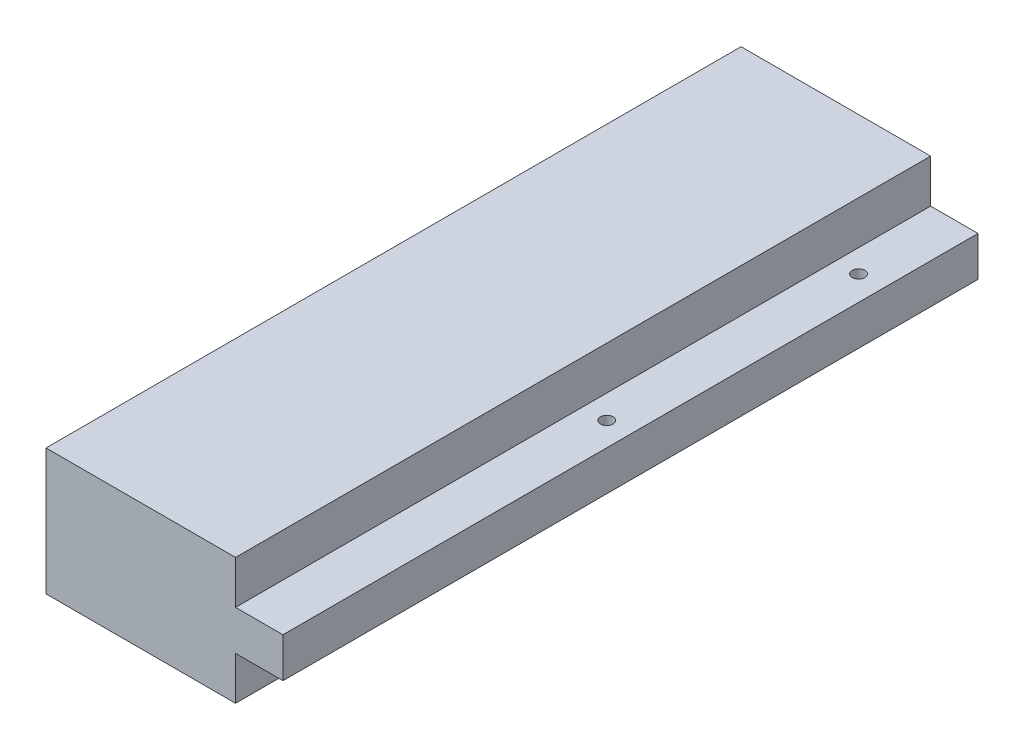
from build123d import *

# Parameters (mm, degrees)
BOSS_EXTRU_1_DEPTH      = 1100
ENL_V_MAT_EXTRU_1_REACH = 1171.58
ESQUISSE2_R             = 10
ENL_V_MAT_EXTRU_2_REACH = 1171.58
ESQUISSE3_R             = 10


with BuildPart() as part:
    # Esquisse1 → Boss.-Extru.1 (new body)
    with BuildSketch(Plane.XY):
        Polygon((0, 0), (300, 0), (300, 68.5), (375, 68.5), (375, 131.5), (300, 131.5), (300, 200), (0, 200), align=None)
    extrude(amount=BOSS_EXTRU_1_DEPTH)

    # Esquisse2 → Enlèv. mat.-Extru.1 (cut, up to next)
    with BuildSketch(Plane.XZ.offset(-68.5), mode=Mode.PRIVATE) as enl_v_mat_extru_1_sk1:
        with Locations(Location((337.5, 550, 0), (0, 0, 270))):
            Circle(ESQUISSE2_R)
    enl_v_mat_extru_1_tool1 = extrude(enl_v_mat_extru_1_sk1.sketch, amount=-ENL_V_MAT_EXTRU_1_REACH, mode=Mode.PRIVATE) & part.part
    add(enl_v_mat_extru_1_tool1.solids().sort_by_distance((337.5, 68.5, 550))[0], mode=Mode.SUBTRACT)

    # Esquisse3 → Enlèv. mat.-Extru.2 (cut, up to next)
    with BuildSketch(Plane.XZ.offset(-68.5), mode=Mode.PRIVATE) as enl_v_mat_extru_2_sk1:
        with Locations(Location((336.011391588, 150, 0), (0, 0, 270))):
            Circle(ESQUISSE3_R)
    enl_v_mat_extru_2_tool1 = extrude(enl_v_mat_extru_2_sk1.sketch, amount=-ENL_V_MAT_EXTRU_2_REACH, mode=Mode.PRIVATE) & part.part
    add(enl_v_mat_extru_2_tool1.solids().sort_by_distance((336.011392, 68.5, 150))[0], mode=Mode.SUBTRACT)


solid = part.part
